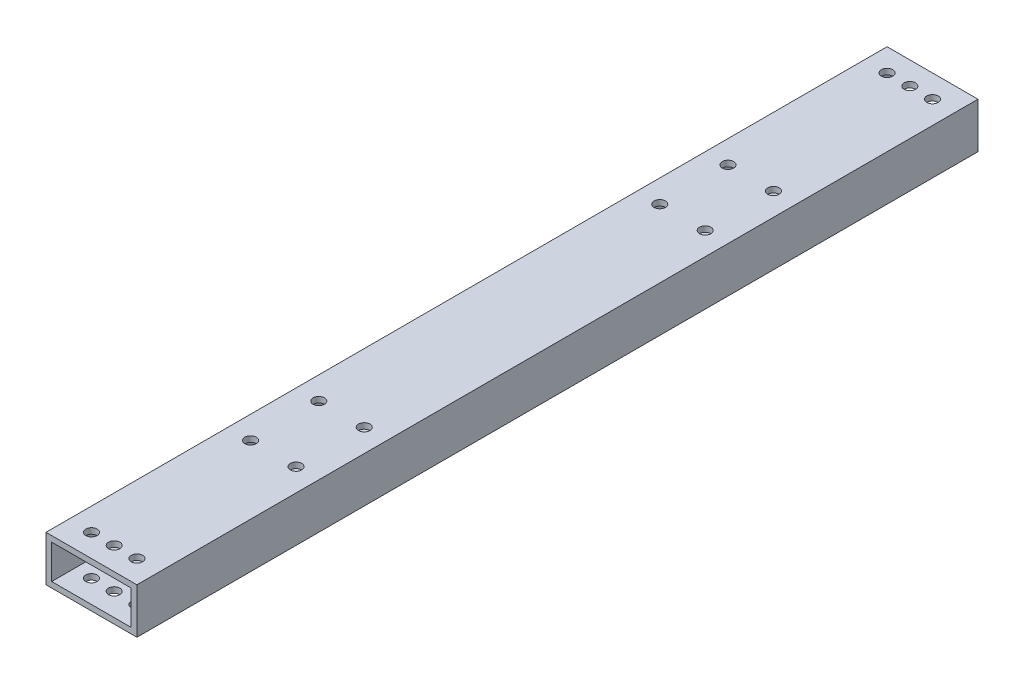
from build123d import *

# Parameters (mm, degrees)
SKETCH1_W               = 50.8
SKETCH1_H               = 25.4
SKETCH1_W_2             = 44.45
SKETCH1_H_2             = 19.05
BOSS_EXTRUDE1_DEPTH     = 469.9
CUT_EXTRUDE1_DEPTH      = 474.319986901
CUT_EXTRUDE1_DEPTH_BACK = 474.319986901
SKETCH3_R               = 3.175
CUT_EXTRUDE2_DEPTH      = 474.319986901
CUT_EXTRUDE2_DEPTH_BACK = 474.319986901
SKETCH4_R               = 3.175


with BuildPart() as part:
    # Sketch1 → Boss-Extrude1 (new body)
    with BuildSketch(Plane.XY):
        with Locations((25.4, 12.7)):
            Rectangle(SKETCH1_W, SKETCH1_H)
        with Locations((25.4, 12.7)):
            Rectangle(SKETCH1_W_2, SKETCH1_H_2, mode=Mode.SUBTRACT)
    extrude(amount=BOSS_EXTRUDE1_DEPTH)

    # Sketch3 → Cut-Extrude1 (cut, two sides: drawn at the far end of the back side and taken through both)
    with BuildSketch(Plane(origin=(0, 25.4, 0), x_dir=(1, 0, 0), z_dir=(0, 1, 0)).offset(-CUT_EXTRUDE1_DEPTH_BACK)):
        with Locations(Location((12.7, -12.7, 0), (0, 0, 270))):
            Circle(SKETCH3_R)
        with Locations(Location((12.7, -457.2, 0), (0, 0, 270))):
            Circle(SKETCH3_R)
        with Locations(Location((25.4, -457.2, 0), (0, 0, 270))):
            Circle(SKETCH3_R)
        with Locations(Location((25.4, -12.7, 0), (0, 0, 270))):
            Circle(SKETCH3_R)
        with Locations(Location((38.1, -457.2, 0), (0, 0, 270))):
            Circle(SKETCH3_R)
        with Locations(Location((38.1, -12.7, 0), (0, 0, 270))):
            Circle(SKETCH3_R)
    extrude(amount=CUT_EXTRUDE1_DEPTH + CUT_EXTRUDE1_DEPTH_BACK, mode=Mode.SUBTRACT)

    # Sketch4 → Cut-Extrude2 (cut, two sides: drawn at the far end of the back side and taken through both)
    with BuildSketch(Plane(origin=(0, 25.4, 0), x_dir=(1, 0, 0), z_dir=(0, 1, 0)).offset(-CUT_EXTRUDE2_DEPTH_BACK)):
        with Locations(Location((12.7, -139.7, 0), (0, 0, 90))):
            Circle(SKETCH4_R)
        with Locations(Location((12.7, -330.2, 0), (0, 0, 90))):
            Circle(SKETCH4_R)
        with Locations(Location((12.7, -101.6, 0), (0, 0, 90))):
            Circle(SKETCH4_R)
        with Locations(Location((12.7, -368.3, 0), (0, 0, 90))):
            Circle(SKETCH4_R)
        with Locations(Location((38.1, -101.6, 0), (0, 0, 90))):
            Circle(SKETCH4_R)
        with Locations(Location((38.1, -139.7, 0), (0, 0, 90))):
            Circle(SKETCH4_R)
        with Locations(Location((38.1, -330.2, 0), (0, 0, 90))):
            Circle(SKETCH4_R)
        with Locations(Location((38.1, -368.3, 0), (0, 0, 90))):
            Circle(SKETCH4_R)
    extrude(amount=CUT_EXTRUDE2_DEPTH + CUT_EXTRUDE2_DEPTH_BACK, mode=Mode.SUBTRACT)


solid = part.part
